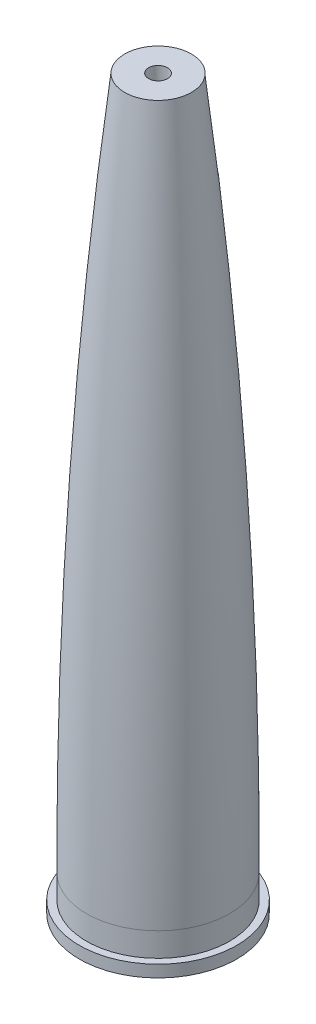
from build123d import *


with BuildPart() as part:
    # Sketch1 → Revolve-Thin1 (revolve)
    with BuildSketch(Plane.XY, mode=Mode.PRIVATE) as revolve_thin1_sk:
        with BuildLine():
            Line((-76.2, -267.162329894), (-76.2, -292.562329894))
            Line((-76.2, -292.562329894), (-83.82, -292.562329894))
            Line((-83.82, -292.562329894), (-83.82, -305.262329894))
            Line((-83.82, -305.262329894), (-10.081210505, -305.262329894))
            Line((-10.081210505, -305.262329894), (-10.081210505, 469.437670106))
            Line((-10.081210505, 469.437670106), (-35.481210505, 469.437670106))
            ThreePointArc((-35.481210505, 469.437670106), (-66.318439793, 101.716878278), (-76.2, -267.162329894))
        make_face()
        with BuildLine():
            Line((-73.66, -267.160221674), (-73.66, -295.102329894))
            Line((-73.66, -295.102329894), (-81.28, -295.102329894))
            Line((-81.28, -295.102329894), (-81.28, -302.722329894))
            Line((-81.28, -302.722329894), (-12.621210505, -302.722329894))
            Line((-12.621210505, -302.722329894), (-12.621210505, 466.897670106))
            Line((-12.621210505, 466.897670106), (-33.210714263, 466.897670106))
            ThreePointArc((-33.210714263, 466.897670106), (-63.844918494, 100.442329278), (-73.66, -267.160221674))
        make_face(mode=Mode.SUBTRACT)
    revolve(revolve_thin1_sk.sketch.rotate(Axis((0, 0, 0), (0, 1, 0)), 270), axis=Axis((0, 0, 0), (0, 1, 0)))


solid = part.part
